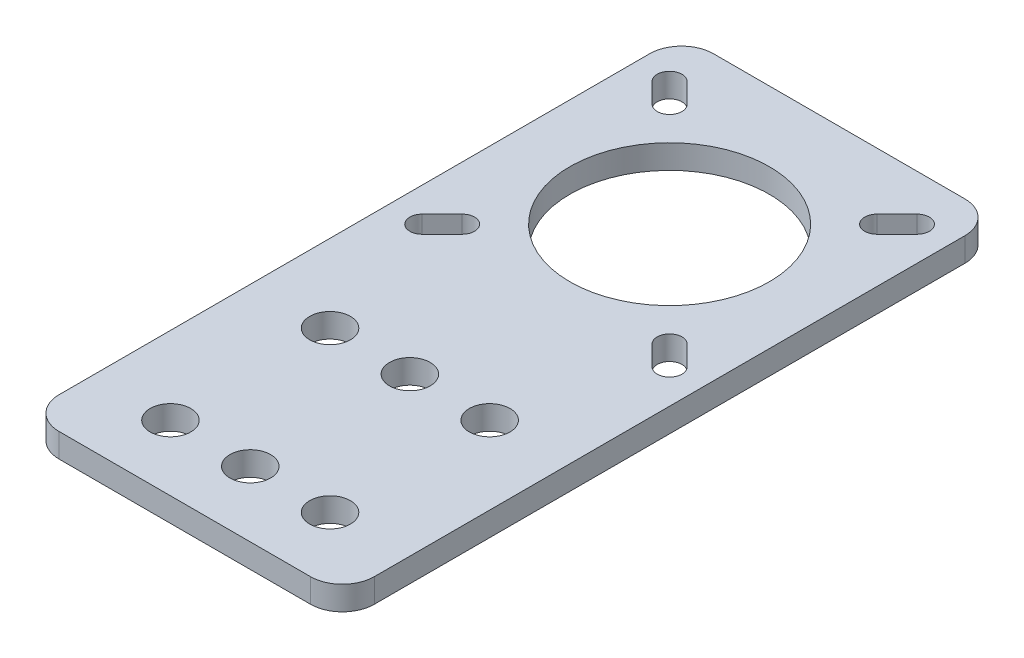
from build123d import *

# Parameters (mm, degrees)
SKETCH1_R           = 12.5
SKETCH1_R_2         = 2.55
BOSS_EXTRUDE1_DEPTH = 3


with BuildPart() as part:
    # Sketch1 → Boss-Extrude1 (new body)
    with BuildSketch(Plane(origin=(0, 0, 0), x_dir=(1, 0, 0), z_dir=(0, 1, 0))):
        with BuildLine():
            Line((15.75, -60.75), (-15.75, -60.75))
            ThreePointArc((-15.75, -60.75), (-18.578427125, -59.578427125), (-19.75, -56.75))
            Line((-19.75, -56.75), (-19.75, 17.25))
            ThreePointArc((-19.75, 17.25), (-18.578427125, 20.078427125), (-15.75, 21.25))
            Line((-15.75, 21.25), (15.75, 21.25))
            ThreePointArc((15.75, 21.25), (18.578427125, 20.078427125), (19.75, 17.25))
            Line((19.75, 17.25), (19.75, -56.75))
            ThreePointArc((19.75, -56.75), (18.578427125, -59.578427125), (15.75, -60.75))
        make_face()
        with Locations(Location((0, 0, 0), (0, 0, 270))):
            Circle(SKETCH1_R, mode=Mode.SUBTRACT)
        with Locations(Location((10, -52.55, 0), (0, 0, 270))):
            Circle(SKETCH1_R_2, mode=Mode.SUBTRACT)
        with Locations(Location((10, -32.55, 0), (0, 0, 270))):
            Circle(SKETCH1_R_2, mode=Mode.SUBTRACT)
        with Locations(Location((0, -52.55, 0), (0, 0, 270))):
            Circle(SKETCH1_R_2, mode=Mode.SUBTRACT)
        with Locations(Location((0, -32.55, 0), (0, 0, 270))):
            Circle(SKETCH1_R_2, mode=Mode.SUBTRACT)
        with Locations(Location((-10, -52.55, 0), (0, 0, 270))):
            Circle(SKETCH1_R_2, mode=Mode.SUBTRACT)
        with Locations(Location((-10, -32.55, 0), (0, 0, 270))):
            Circle(SKETCH1_R_2, mode=Mode.SUBTRACT)
        with BuildLine():
            Line((11.903984489, 14.096015511), (14.403984489, 16.596015511))
            ThreePointArc((14.403984489, 16.596015511), (16.596015511, 16.596015511), (16.596015511, 14.403984489))
            Line((16.596015511, 14.403984489), (14.096015511, 11.903984489))
            ThreePointArc((14.096015511, 11.903984489), (11.903984489, 11.903984489), (11.903984489, 14.096015511))
        make_face(mode=Mode.SUBTRACT)
        with BuildLine():
            Line((-11.903984489, 14.096015511), (-14.403984489, 16.596015511))
            ThreePointArc((-14.403984489, 16.596015511), (-16.596015511, 16.596015511), (-16.596015511, 14.403984489))
            Line((-16.596015511, 14.403984489), (-14.096015511, 11.903984489))
            ThreePointArc((-14.096015511, 11.903984489), (-11.903984489, 11.903984489), (-11.903984489, 14.096015511))
        make_face(mode=Mode.SUBTRACT)
        with BuildLine():
            Line((-11.903984489, -14.096015511), (-14.403984489, -16.596015511))
            ThreePointArc((-14.403984489, -16.596015511), (-16.596015511, -16.596015511), (-16.596015511, -14.403984489))
            Line((-16.596015511, -14.403984489), (-14.096015511, -11.903984489))
            ThreePointArc((-14.096015511, -11.903984489), (-11.903984489, -11.903984489), (-11.903984489, -14.096015511))
        make_face(mode=Mode.SUBTRACT)
        with BuildLine():
            Line((11.903984489, -14.096015511), (14.403984489, -16.596015511))
            ThreePointArc((14.403984489, -16.596015511), (16.596015511, -16.596015511), (16.596015511, -14.403984489))
            Line((16.596015511, -14.403984489), (14.096015511, -11.903984489))
            ThreePointArc((14.096015511, -11.903984489), (11.903984489, -11.903984489), (11.903984489, -14.096015511))
        make_face(mode=Mode.SUBTRACT)
    extrude(amount=BOSS_EXTRUDE1_DEPTH)


solid = part.part
